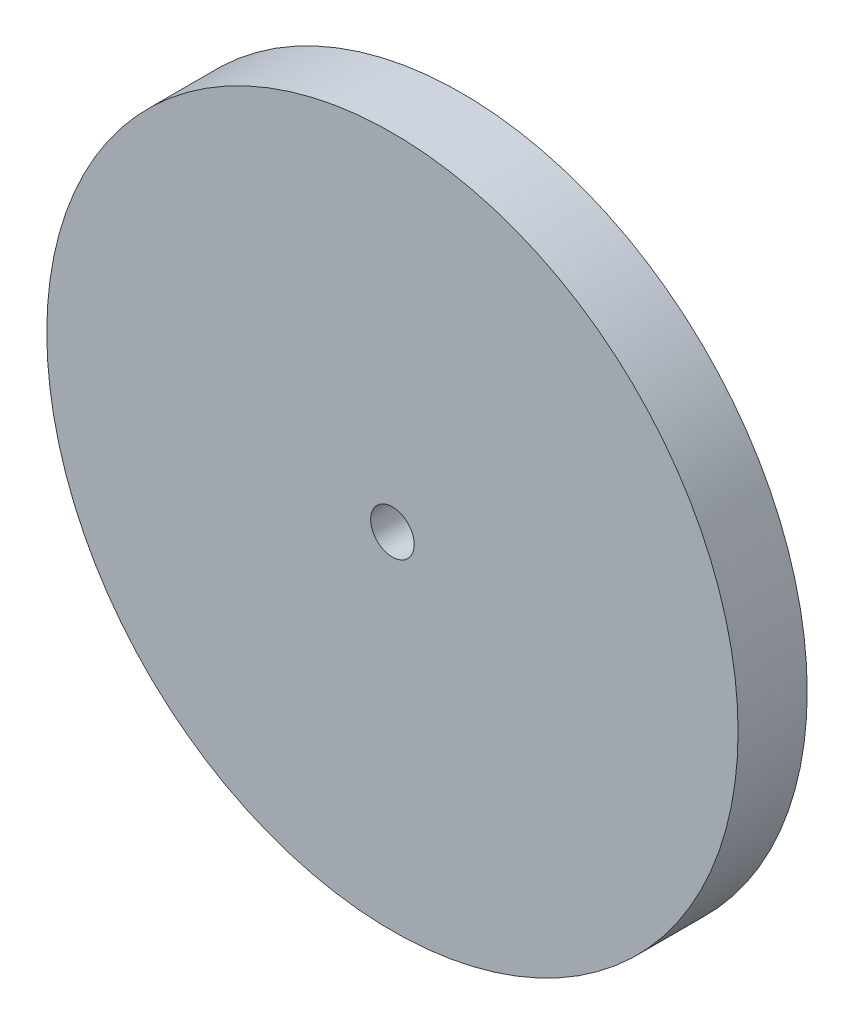
from build123d import *

# Parameters (mm, degrees)
SKETCH1_R           = 63.5
SKETCH1_R_2         = 4
BOSS_EXTRUDE1_DEPTH = 12.7


with BuildPart() as part:
    # Sketch1 → Boss-Extrude1 (new body)
    with BuildSketch(Plane.XY):
        Circle(SKETCH1_R)
        Circle(SKETCH1_R_2, mode=Mode.SUBTRACT)
    extrude(amount=BOSS_EXTRUDE1_DEPTH)


solid = part.part
